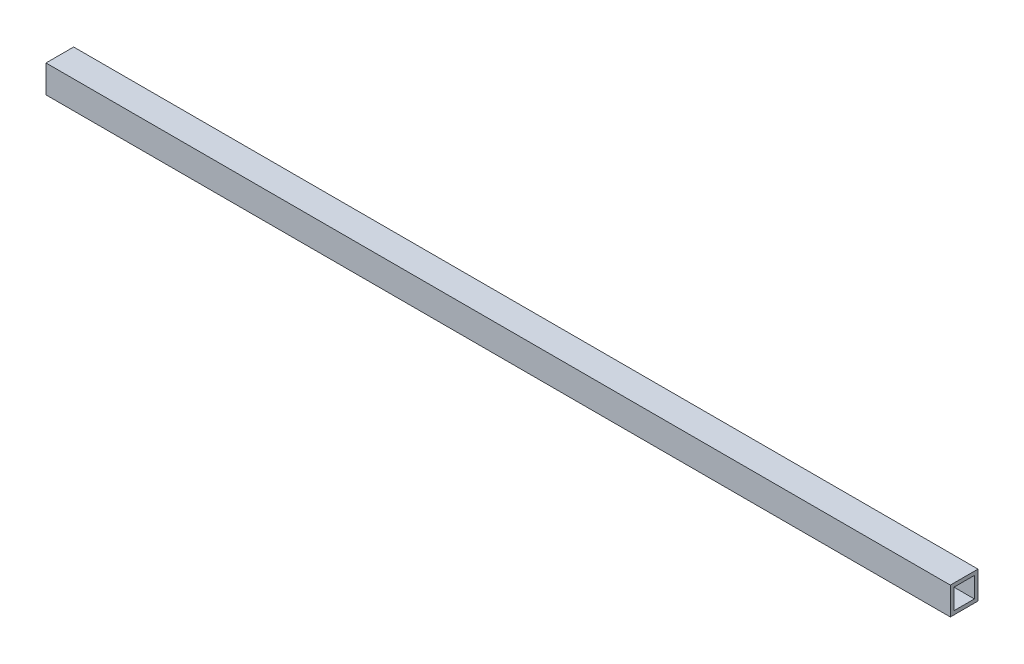
from build123d import *

# Parameters (mm, degrees)
SKETCH1_W           = 38
SKETCH1_H           = 38
SKETCH1_W_2         = 28
SKETCH1_H_2         = 28
BOSS_EXTRUDE1_DEPTH = 1242


with BuildPart() as part:
    # Sketch1 → Boss-Extrude1 (new body)
    with BuildSketch(Plane(origin=(0, 0, 0), x_dir=(0, 0, -1), z_dir=(1, 0, 0))):
        with Locations((19, 19)):
            Rectangle(SKETCH1_W, SKETCH1_H)
        with Locations((19, 19)):
            Rectangle(SKETCH1_W_2, SKETCH1_H_2, mode=Mode.SUBTRACT)
    extrude(amount=BOSS_EXTRUDE1_DEPTH)


solid = part.part
